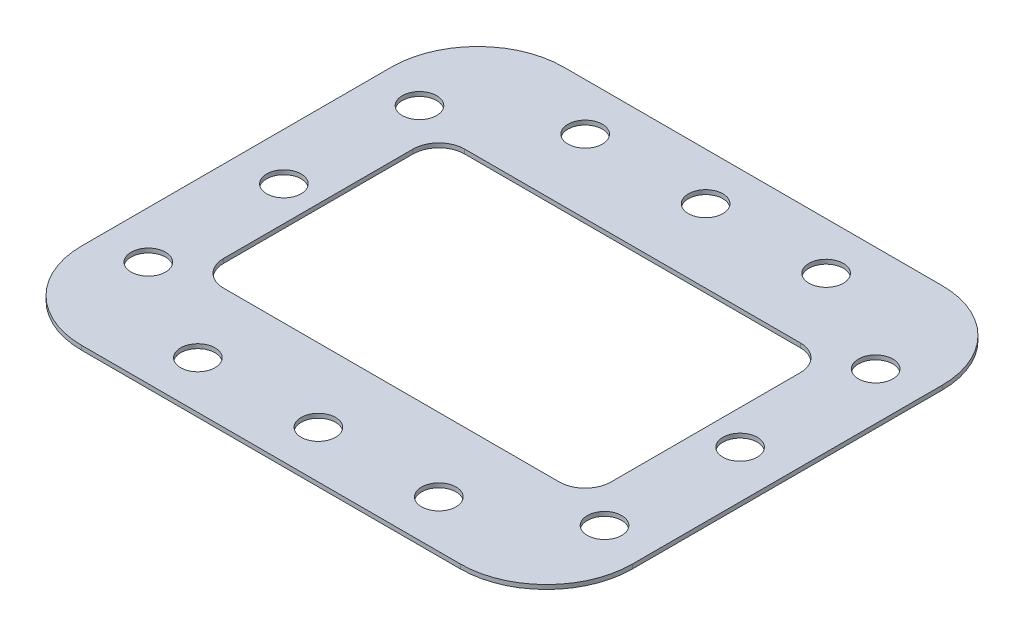
from build123d import *

# Parameters (mm, degrees)
SKETCH_1_R      = 4
EXTRUDE_1_DEPTH = 1


with BuildPart() as part:
    # 草图1 → 凸台-拉伸1 (new body)
    with BuildSketch(Plane(origin=(0, 0, 0), x_dir=(1, 0, 0), z_dir=(0, 1, 0))):
        with BuildLine():
            Line((-44, -56), (44, -56))
            ThreePointArc((44, -56), (58.142135624, -50.142135624), (64, -36))
            Line((64, -36), (64, 36))
            ThreePointArc((64, 36), (58.142135624, 50.142135624), (44, 56))
            Line((44, 56), (-44, 56))
            ThreePointArc((-44, 56), (-58.142135624, 50.142135624), (-64, 36))
            Line((-64, 36), (-64, -36))
            ThreePointArc((-64, -36), (-58.142135624, -50.142135624), (-44, -56))
        make_face()
        with Locations(Location((-28, 45, 0), (0, 0, 270))):
            Circle(SKETCH_1_R, mode=Mode.SUBTRACT)
        with Locations(Location((0, 45, 0), (0, 0, 270))):
            Circle(SKETCH_1_R, mode=Mode.SUBTRACT)
        with Locations(Location((28, 45, 0), (0, 0, 90))):
            Circle(SKETCH_1_R, mode=Mode.SUBTRACT)
        with Locations(Location((-53, 31.5, 0), (0, 0, 270))):
            Circle(SKETCH_1_R, mode=Mode.SUBTRACT)
        with Locations(Location((-53, 0, 0), (0, 0, 270))):
            Circle(SKETCH_1_R, mode=Mode.SUBTRACT)
        with Locations(Location((-53, -31.5, 0), (0, 0, 90))):
            Circle(SKETCH_1_R, mode=Mode.SUBTRACT)
        with Locations(Location((53, 31.5, 0), (0, 0, 90))):
            Circle(SKETCH_1_R, mode=Mode.SUBTRACT)
        with Locations(Location((53, 0, 0), (0, 0, 90))):
            Circle(SKETCH_1_R, mode=Mode.SUBTRACT)
        with Locations(Location((53, -31.5, 0), (0, 0, 270))):
            Circle(SKETCH_1_R, mode=Mode.SUBTRACT)
        with Locations(Location((28, -45, 0), (0, 0, 270))):
            Circle(SKETCH_1_R, mode=Mode.SUBTRACT)
        with Locations(Location((0, -45, 0), (0, 0, 90))):
            Circle(SKETCH_1_R, mode=Mode.SUBTRACT)
        with Locations(Location((-28, -45, 0), (0, 0, 90))):
            Circle(SKETCH_1_R, mode=Mode.SUBTRACT)
        with BuildLine():
            Line((-39, -28), (39, -28))
            ThreePointArc((39, -28), (43.242640687, -26.242640687), (45, -22))
            Line((45, -22), (45, 22))
            ThreePointArc((45, 22), (43.242640687, 26.242640687), (39, 28))
            Line((39, 28), (-39, 28))
            ThreePointArc((-39, 28), (-43.242640687, 26.242640687), (-45, 22))
            Line((-45, 22), (-45, -22))
            ThreePointArc((-45, -22), (-43.242640687, -26.242640687), (-39, -28))
        make_face(mode=Mode.SUBTRACT)
    extrude(amount=EXTRUDE_1_DEPTH)


solid = part.part
